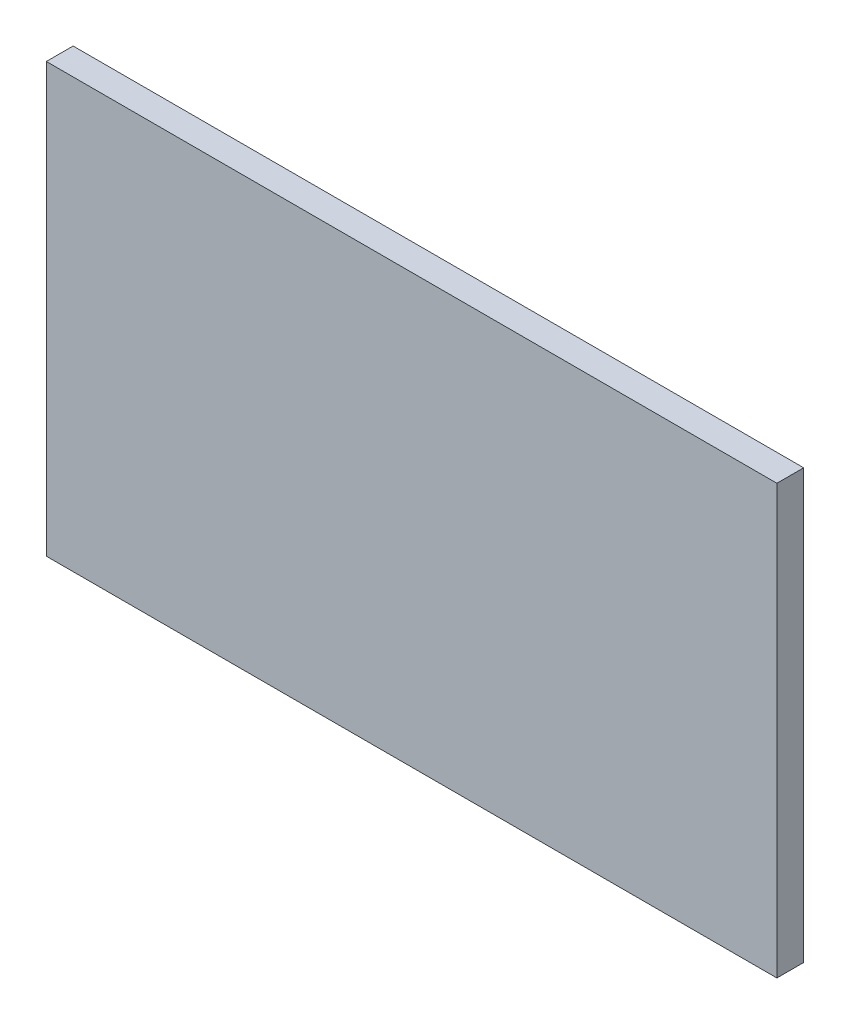
from build123d import *

# Parameters (mm, degrees)
SKETCH1_W           = 682
SKETCH1_H           = 400
BOSS_EXTRUDE1_DEPTH = 25


with BuildPart() as part:
    # Sketch1 → Boss-Extrude1 (new body)
    with BuildSketch(Plane.XY):
        with Locations((341, 200)):
            Rectangle(SKETCH1_W, SKETCH1_H)
    extrude(amount=BOSS_EXTRUDE1_DEPTH)


solid = part.part
